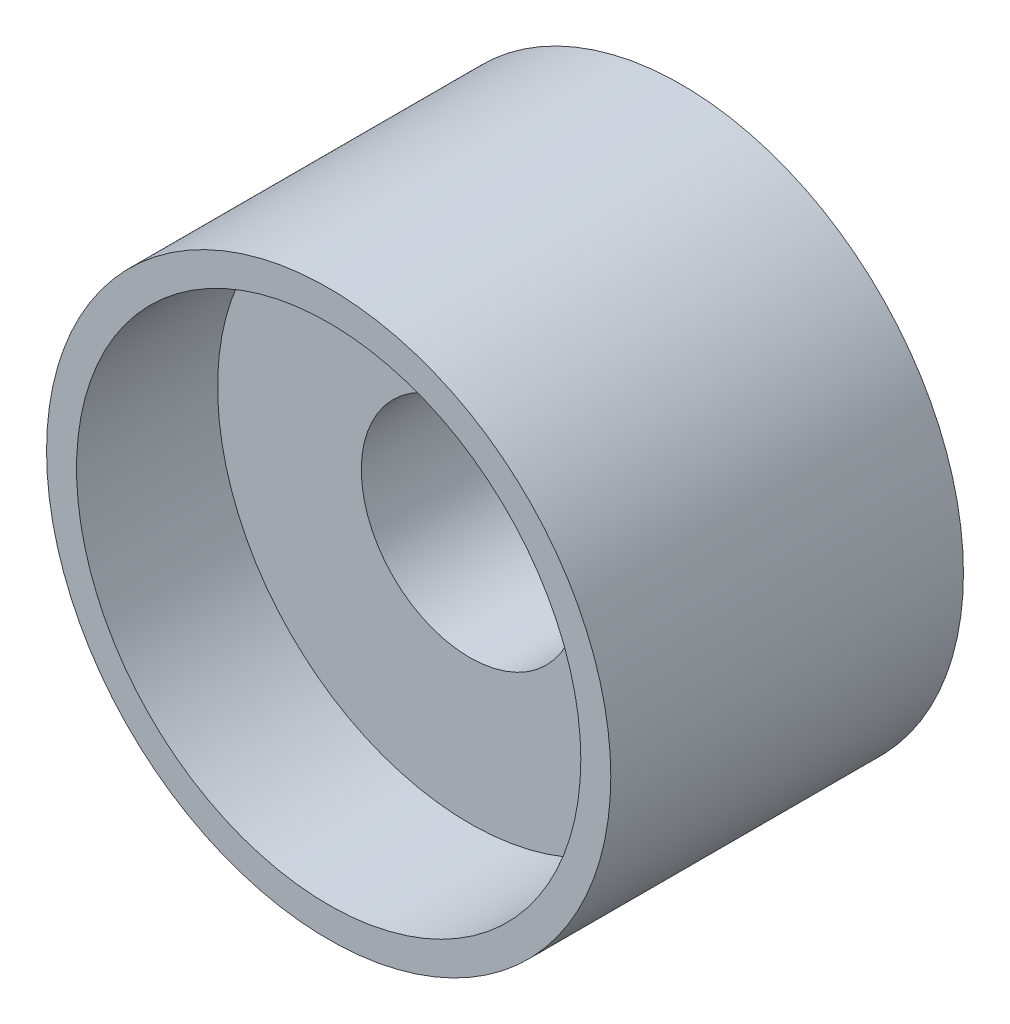
from build123d import *

# Parameters (mm, degrees)
SKETCH1_R           = 16
SKETCH1_R_2         = 6.15
BOSS_EXTRUDE1_DEPTH = 20
SKETCH2_R           = 14.3
CUT_EXTRUDE1_DEPTH  = 8


with BuildPart() as part:
    # Sketch1 → Boss-Extrude1 (new body)
    with BuildSketch(Plane.XY):
        Circle(SKETCH1_R)
        Circle(SKETCH1_R_2, mode=Mode.SUBTRACT)
    extrude(amount=BOSS_EXTRUDE1_DEPTH)

    # Sketch2 → Cut-Extrude1 (cut)
    with BuildSketch(Plane.XY.offset(20)):
        Circle(SKETCH2_R)
    extrude(amount=-CUT_EXTRUDE1_DEPTH, mode=Mode.SUBTRACT)


solid = part.part
